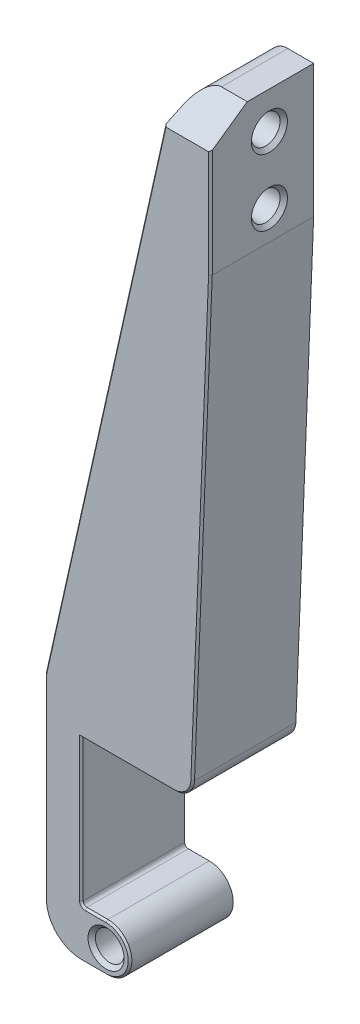
from build123d import *

# Parameters (mm, degrees)
SKETCH1_R           = 3.9
BOSS_EXTRUDE1_DEPTH = 28
SKETCH4_R           = 3.9
CUT_EXTRUDE2_DEPTH  = 10
CUT_EXTRUDE3_DEPTH  = 24
CHAMFER1_SIZE       = 1
CUT_EXTRUDE4_DEPTH  = 171.449405983
BOSS_EXTRUDE2_START = 8
BOSS_EXTRUDE2_DEPTH = 8
FILLET1_R           = 3
CHAMFER2_SIZE       = 0.5


with BuildPart() as part:
    # Sketch1 → Boss-Extrude1 (new body)
    with BuildSketch(Plane.XY):
        with BuildLine():
            Line((6.7, -39.5), (1, -39.5))
            ThreePointArc((1, -39.5), (0.292893219, -39.207106781), (0, -38.5))
            Line((0, -38.5), (0, 0))
            Line((0, 0), (25.194477487, 0))
            ThreePointArc((25.194477487, 0), (28.659208118, 1.395053169), (30.190545371, 4.801743338))
            Line((30.190545371, 4.801743338), (35, 126))
            Line((35, 126), (35, 162))
            Line((35, 162), (28.005138809, 162))
            ThreePointArc((28.005138809, 162), (24.87921862, 160.902386831), (23.125718898, 158.091449191))
            Line((23.125718898, 158.091449191), (-9.879419911, 10.539063929))
            ThreePointArc((-9.879419911, 10.539063929), (-9.969763553, 9.996659567), (-10, 9.447614738))
            Line((-10, 9.447614738), (-10, -42.5))
            ThreePointArc((-10, -42.5), (-7.071067812, -49.571067812), (0, -52.5))
            Line((0, -52.5), (6.7, -52.5))
            ThreePointArc((6.7, -52.5), (13.2, -46), (6.7, -39.5))
        make_face()
        with Locations((6.7, -46)):
            Circle(SKETCH1_R, mode=Mode.SUBTRACT)
    extrude(amount=BOSS_EXTRUDE1_DEPTH)

    # Sketch4 → Cut-Extrude2 (cut)
    with BuildSketch(Plane(origin=(35, 0, 0), x_dir=(0, 0, -1), z_dir=(1, 0, 0))):
        with Locations((-12, 152)):
            Circle(SKETCH4_R)
        with Locations((-12, 134)):
            Circle(SKETCH4_R)
    extrude(amount=-CUT_EXTRUDE2_DEPTH, mode=Mode.SUBTRACT)

    # Sketch5 → Cut-Extrude3 (cut)
    with BuildSketch(Plane.XY):
        with BuildLine():
            Line((-4.440935128, 16.528028867), (18.877520205, 120.775240942))
            ThreePointArc((18.877520205, 120.775240942), (25.509806245, 125.414980777), (30.728105558, 119.227593919))
            Line((30.728105558, 119.227593919), (26.581075667, 14.722440673))
            ThreePointArc((26.581075667, 14.722440673), (24.437203514, 9.953074436), (19.58658063, 8))
            Line((19.58658063, 8), (2.390252747, 8))
            ThreePointArc((2.390252747, 8), (-3.073088816, 10.623711736), (-4.440935128, 16.528028867))
        make_face()
    extrude(amount=CUT_EXTRUDE3_DEPTH, mode=Mode.SUBTRACT)

    # Chamfer1
    chamfer1_edges = [part.edges().sort_by_distance(p)[0] for p in [
        (2.8, -46, 0),
        (2.8, -46, 28),
        (35, 152, 15.9),
        (35, 134, 15.9),
    ]]
    chamfer(chamfer1_edges, length=CHAMFER1_SIZE)

    # Sketch6 → Cut-Extrude4 (cut, through all)
    with BuildSketch(Plane(origin=(35, 0, 0), x_dir=(0, 0, -1), z_dir=(1, 0, 0))):
        Polygon((-18, 162), (-28, 154.997924618), (-28, 162), align=None)
    extrude(amount=-CUT_EXTRUDE4_DEPTH, mode=Mode.SUBTRACT)

    # Sketch7 → Boss-Extrude2 (add)
    with BuildSketch(Plane(origin=(0, 0, 24), x_dir=(-1, 0, 0), z_dir=(0, 0, -1)).offset(BOSS_EXTRUDE2_START)):
        with BuildLine():
            Line((-26.7218562, 119.256333807), (-22.401525887, 78.173226899))
            Line((-22.401525887, 78.173226899), (-29.088434109, 77.907873398))
            Line((-29.088434109, 77.907873398), (-28.929828779, 73.911019091))
            Line((-28.929828779, 73.911019091), (-21.982301269, 74.186714627))
            Line((-21.982301269, 74.186714627), (-15.022056754, 8))
            Line((-15.022056754, 8), (-11, 8))
            Line((-11, 8), (-17.976958991, 74.345656781))
            Line((-17.976958991, 74.345656781), (-8.575406865, 74.718734246))
            Line((-8.575406865, 74.718734246), (-9.462969579, 78.686661673))
            Line((-9.462969579, 78.686661673), (-18.396183609, 78.332169052))
            Line((-18.396183609, 78.332169052), (-22.743791996, 119.67467002))
            ThreePointArc((-22.743791996, 119.67467002), (-20.963928, 121.872870229), (-18.765727791, 120.093006233))
            ThreePointArc((-18.765727791, 120.093006233), (-25.360328417, 125.43259822), (-30.699920404, 118.837997594))
            ThreePointArc((-30.699920404, 118.837997594), (-28.920056409, 121.036197803), (-26.7218562, 119.256333807))
        make_face()
    extrude(amount=-BOSS_EXTRUDE2_DEPTH)

    # Fillet1
    fillet1_edges = [part.edges().sort_by_distance(p)[0] for p in [
        (21.982301269, 74.186714627, 20),
        (15.022056754, 8, 20),
        (11, 8, 20),
        (17.976958991, 74.345656781, 20),
        (8.575406865, 74.718734246, 20),
        (9.462969579, 78.686661673, 20),
        (18.396183609, 78.332169052, 20),
        (22.401525887, 78.173226899, 20),
        (29.088434109, 77.907873398, 20),
        (28.929828779, 73.911019091, 20),
    ]]
    fillet(fillet1_edges, radius=FILLET1_R)

    # Chamfer2
    chamfer2_edges = [part.edges().sort_by_distance(p)[0] for p in [
        (32.595272685, 65.400871669, 28),
        (35, 140.498962309, 28),
        (-9.969763553, 9.996659567, 28),
        (-10, -16.526192631, 28),
        (-7.071067812, -49.571067812, 28),
        (3.35, -52.5, 28),
        (13.2, -46, 28),
        (12.597238744, 0, 28),
        (3.85, -39.5, 28),
        (0.292893219, -39.207106781, 28),
        (0, -19.25, 28),
        (28.659208118, 1.395053169, 28),
        (6.277163193, 82.768494273, 28),
    ]]
    chamfer(chamfer2_edges, length=CHAMFER2_SIZE)


solid = part.part
